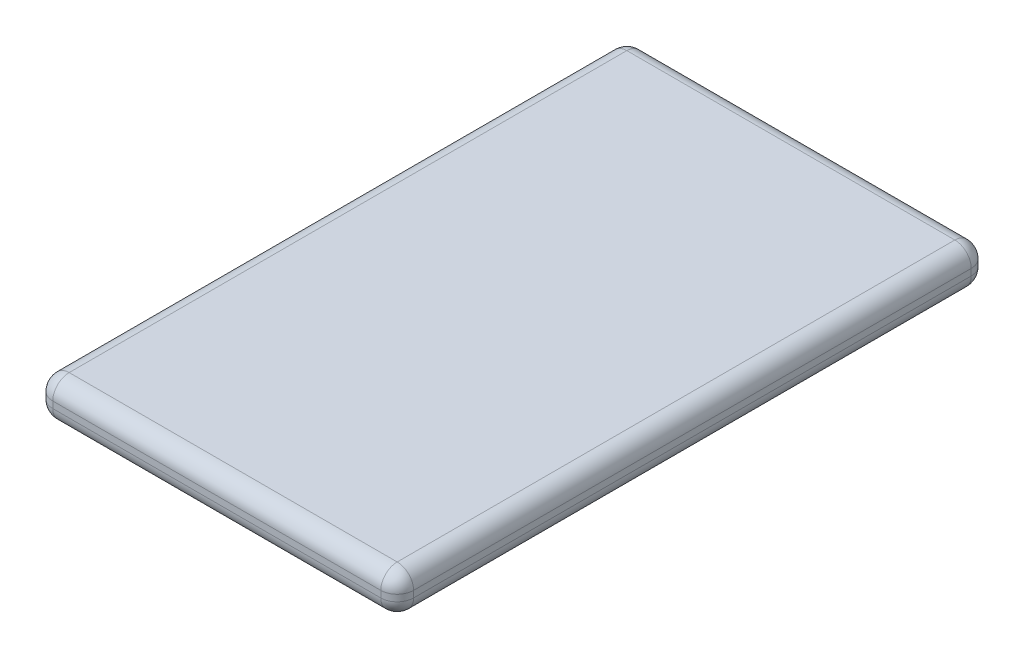
from build123d import *

# Parameters (mm, degrees)
SKETCH1_W           = 55
SKETCH1_H           = 90
BOSS_EXTRUDE1_DEPTH = 6
FILLET1_R           = 2.5


with BuildPart() as part:
    # Sketch1 → Boss-Extrude1 (new body)
    with BuildSketch(Plane(origin=(0, 0, 0), x_dir=(1, 0, 0), z_dir=(0, 1, 0))):
        with Locations((27.5, -45)):
            Rectangle(SKETCH1_W, SKETCH1_H)
    extrude(amount=BOSS_EXTRUDE1_DEPTH)

    # Fillet1
    fillet1_edges = [part.edges().sort_by_distance(p)[0] for p in [
        (55, 6, 45),
        (27.5, 6, 0),
        (0, 6, 45),
        (27.5, 0, 0),
        (55, 0, 45),
        (27.5, 0, 90),
        (0, 0, 45),
        (27.5, 6, 90),
        (0, 3, 0),
        (55, 3, 0),
        (55, 3, 90),
        (0, 3, 90),
    ]]
    fillet(fillet1_edges, radius=FILLET1_R)


solid = part.part
